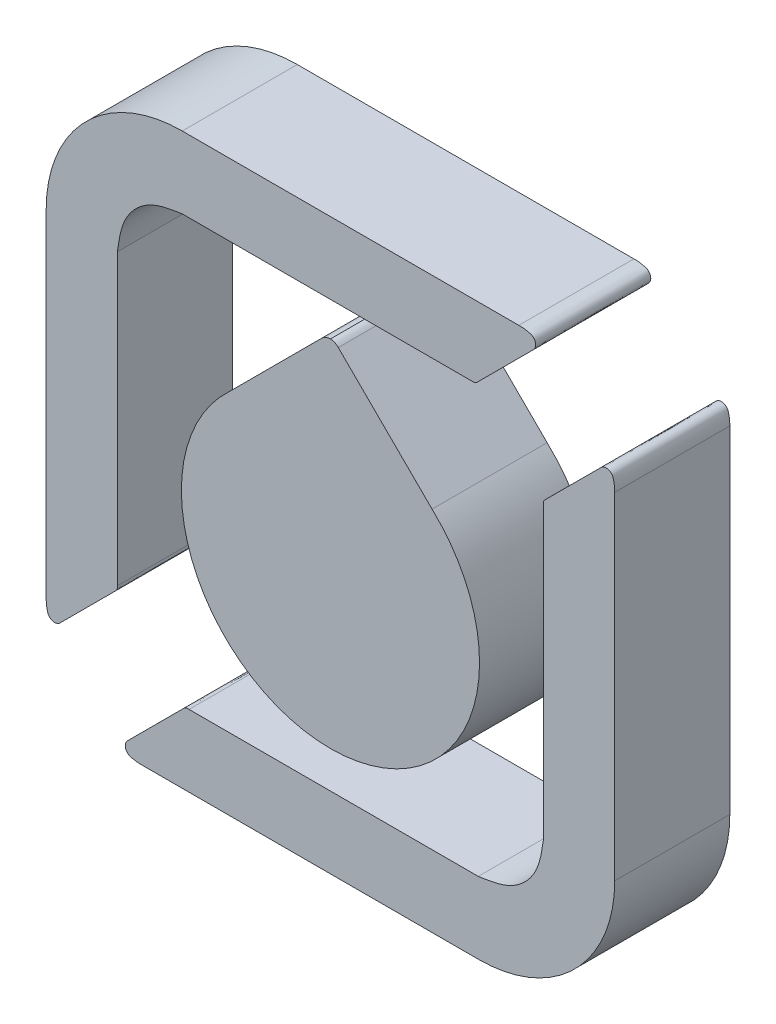
from build123d import *

# Parameters (mm, degrees)
BOSS_EXTRUDE1_DEPTH   = 6
BOSS_EXTRUDE1_2_DEPTH = 6
BOSS_EXTRUDE1_3_DEPTH = 6


with BuildPart() as part:
    # Sketch2 → Boss-Extrude1 (new body)
    with BuildSketch(Plane.XY):
        with BuildLine():
            Line((-0.443808512, 55.984274583), (-5.297244805, 51.131120289))
            ThreePointArc((-5.297244805, 51.131120289), (0, 37.672973009), (5.297244805, 51.131120289))
            Line((5.297244805, 51.131120289), (0.407829784, 55.984274583))
            add(Edge.make_bspline(
                [(0.407829784, 55.984274583), (0.368694639, 56.018150383), (0.291347372, 56.085103007), (0.15161935, 56.154367662), (0.050542727, 56.164189345), (5.56e-05, 56.169095213)],
                knots=[0, 0, 0, 0, 0.338885039, 0.6697773, 1, 1, 1, 1], degree=3))
            add(Edge.make_bspline(
                [(5.56e-05, 56.169095213), (-0.05257804, 56.164008855), (-0.160972548, 56.153533933), (-0.315204963, 56.089735455), (-0.401165502, 56.019243828), (-0.443808512, 55.984274583)],
                knots=[0, 0, 0, 0, 0.322338023, 0.663827768, 1, 1, 1, 1], degree=3))
        make_face()
    extrude(amount=BOSS_EXTRUDE1_DEPTH)


with BuildPart() as body_2:
    # Sketch2 → Boss-Extrude1 2 (new body)
    with BuildSketch(Plane.XY):
        with BuildLine():
            Line((-7.706246934, 57.951214685), (7.372918204, 57.951214685))
            add(Edge.make_bspline(
                [(7.372918204, 57.951214685), (7.395110156, 57.950651705), (7.438614819, 57.949548051), (7.504225261, 57.950625459), (7.555781235, 57.971549168), (7.594142025, 57.993251928), (7.6196821, 58.014176428), (7.635431909, 58.027775879), (7.643125702, 58.03441922)],
                knots=[0, 0, 0, 0, 0.227492727, 0.445972237, 0.663373124, 0.787115425, 0.896005733, 1, 1, 1, 1], degree=3))
            Line((7.643125702, 58.03441922), (10.59644992, 60.987402087))
            add(Edge.make_bspline(
                [(10.59644992, 60.987402087), (10.625456983, 61.026663762), (10.683538077, 61.105277754), (10.707695299, 61.253447318), (10.680583073, 61.389397251), (10.6133758, 61.49896423), (10.522988745, 61.577950635), (10.390059362, 61.627458402), (10.229954222, 61.659898091), (10.044878415, 61.693381506), (9.914529471, 61.690948887), (9.843214909, 61.692533466), (9.830847981, 61.693169337), (9.822614549, 61.692592712), (9.818490032, 61.692303853)],
                knots=[0, 0, 0, 0, 0.104345134, 0.208931166, 0.313565445, 0.39799532, 0.482811187, 0.567894079, 0.701186565, 0.836715425, 0.973246641, 0.982162759, 0.991064478, 1, 1, 1, 1], degree=3))
            Line((9.818490032, 61.692303853), (-7.727796486, 61.692303853))
            ThreePointArc((-7.727796486, 61.692303853), (-12.742309897, 59.615224389), (-14.819389361, 54.600710977))
            Line((-14.819389361, 54.600710977), (-14.819389361, 37.055657069))
            add(Edge.make_bspline(
                [(-14.819389361, 37.055657069), (-14.819683443, 37.05167552), (-14.82026435, 37.043810673), (-14.819639427, 37.031949151), (-14.818072735, 36.960744177), (-14.821111299, 36.830160331), (-14.78732224, 36.644666005), (-14.757529562, 36.48379651), (-14.706020153, 36.351730889), (-14.627362714, 36.261445855), (-14.518175826, 36.193440108), (-14.381934797, 36.166179863), (-14.233405716, 36.190514922), (-14.154618978, 36.249229011), (-14.11521277, 36.278595623)],
                knots=[0, 0, 0, 0, 0.008621864, 0.017030969, 0.025643238, 0.162638148, 0.298245388, 0.431901383, 0.516391776, 0.601007159, 0.685956809, 0.790142009, 0.895036806, 1, 1, 1, 1], degree=3))
            Line((-14.11521277, 36.278595623), (-11.198029632, 39.195441586))
            add(Edge.make_bspline(
                [(-11.198029632, 39.195441586), (-11.190093681, 39.205582441), (-11.174520458, 39.225482487), (-11.15027016, 39.255165521), (-11.125422855, 39.293499099), (-11.110689079, 39.344394677), (-11.107300881, 39.404327233), (-11.111709764, 39.443939019), (-11.114003119, 39.464543755)],
                knots=[0, 0, 0, 0, 0.131285455, 0.257629811, 0.390972346, 0.594165008, 0.788898108, 1, 1, 1, 1], degree=3))
            Line((-11.114003119, 39.464543755), (-11.114003119, 54.542930501))
            add(Edge.make_bspline(
                [(-11.114003119, 54.542930501), (-11.025772384, 55.146864843), (-10.853333144, 56.327201592), (-9.491346414, 57.690256382), (-8.310575854, 57.862869665), (-7.706246934, 57.951214685)],
                knots=[0, 0, 0, 0, 0.338409749, 0.6613922, 1, 1, 1, 1], degree=3))
        make_face()
    extrude(amount=BOSS_EXTRUDE1_2_DEPTH)


with BuildPart() as body_3:
    # Sketch2 → Boss-Extrude1 3 (new body)
    with BuildSketch(Plane.XY):
        with BuildLine():
            Line((7.706108935, 35.755985581), (-7.3716965, 35.755985581))
            add(Edge.make_bspline(
                [(-7.3716965, 35.755985581), (-7.390791848, 35.757243364), (-7.42588813, 35.759555105), (-7.480435634, 35.756767712), (-7.526608025, 35.741130321), (-7.568839822, 35.721664455), (-7.605836087, 35.699368029), (-7.62980257, 35.681485074), (-7.642317826, 35.672146626)],
                knots=[0, 0, 0, 0, 0.196745559, 0.361608386, 0.557261599, 0.692766378, 0.839563136, 1, 1, 1, 1], degree=3))
            Line((-7.642317826, 35.672146626), (-10.595729808, 32.719076005))
            add(Edge.make_bspline(
                [(-10.595729808, 32.719076005), (-10.624701104, 32.679767795), (-10.682693852, 32.601083323), (-10.706716869, 32.452917901), (-10.679538616, 32.31693156), (-10.611911158, 32.207498808), (-10.521503266, 32.1288385), (-10.389015109, 32.078886041), (-10.228910201, 32.046334857), (-10.043857278, 32.01606427), (-9.91330711, 32.010562917), (-9.841970676, 32.015780753), (-9.829509786, 32.015147579), (-9.8212444, 32.014980072), (-9.817116366, 32.014896413)],
                knots=[0, 0, 0, 0, 0.104384754, 0.208950226, 0.313569176, 0.398093487, 0.483012464, 0.567612364, 0.700915154, 0.836484685, 0.973043492, 0.982112009, 0.991066088, 1, 1, 1, 1], degree=3))
            Line((-9.817116366, 32.014896413), (7.725721759, 32.014896413))
            ThreePointArc((7.725721759, 32.014896413), (12.741702224, 34.09258355), (14.819389361, 39.108564015))
            Line((14.819389361, 39.108564015), (14.819389361, 56.649953994))
            add(Edge.make_bspline(
                [(14.819389361, 56.649953994), (14.819681538, 56.654088243), (14.820267188, 56.662375085), (14.81963947, 56.674871643), (14.818155381, 56.746304415), (14.820697155, 56.876724498), (14.787319465, 57.061771486), (14.755486312, 57.221842244), (14.705479777, 57.35434308), (14.62689049, 57.444759462), (14.517454165, 57.512357762), (14.3814295, 57.53955279), (14.232961651, 57.515207684), (14.154478031, 57.456521872), (14.115208769, 57.42715844)],
                knots=[0, 0, 0, 0, 0.008953482, 0.017946692, 0.027021307, 0.163490993, 0.298949058, 0.432165007, 0.516776033, 0.601601228, 0.686034701, 0.790672378, 0.895262972, 1, 1, 1, 1], degree=3))
            Line((14.115208769, 57.42715844), (11.198386433, 54.510673236))
            add(Edge.make_bspline(
                [(11.198386433, 54.510673236), (11.189737643, 54.50058532), (11.172712209, 54.480726918), (11.146988546, 54.45027591), (11.11992052, 54.414228702), (11.108014065, 54.36337785), (11.109113984, 54.30464265), (11.112305892, 54.263909284), (11.114003119, 54.242250215)],
                knots=[0, 0, 0, 0, 0.134581529, 0.264928249, 0.404990742, 0.58604785, 0.779890073, 1, 1, 1, 1], degree=3))
            Line((11.114003119, 54.242250215), (11.114003119, 39.164130765))
            add(Edge.make_bspline(
                [(11.114003119, 39.164130765), (11.026069958, 38.560039142), (10.85421565, 37.379418015), (9.491383713, 36.016723245), (8.31051879, 35.844259059), (7.706108935, 35.755985581)],
                knots=[0, 0, 0, 0, 0.33840601, 0.661371999, 1, 1, 1, 1], degree=3))
        make_face()
    extrude(amount=BOSS_EXTRUDE1_3_DEPTH)


solid = Compound([part.part, body_2.part, body_3.part])
